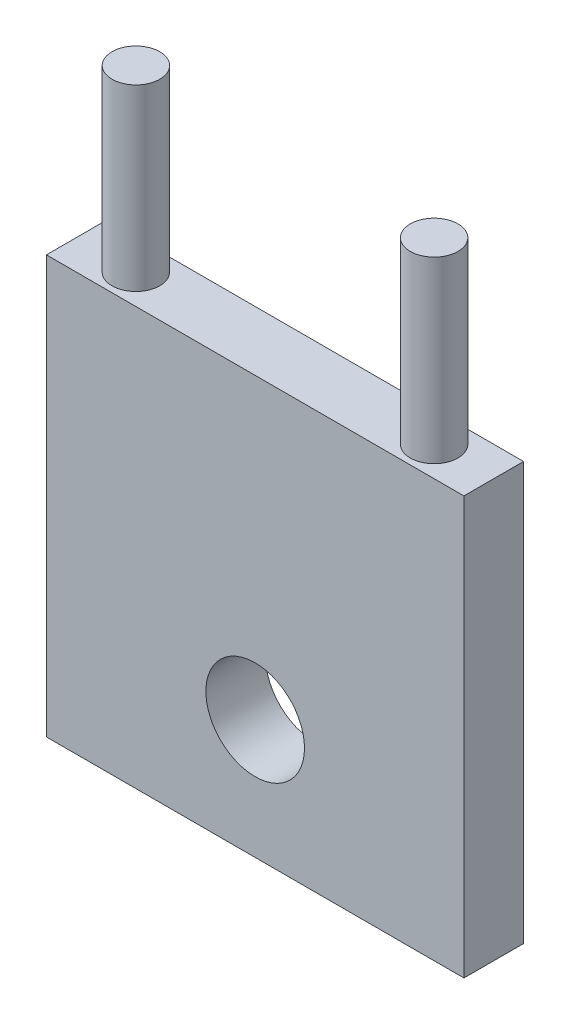
from build123d import *

# Parameters (mm, degrees)
SKETCH1_W           = 17.78
SKETCH1_H           = 17.78
SKETCH1_R           = 2.0999958
BOSS_EXTRUDE1_DEPTH = 2.54
SKETCH2_R           = 1.016
BOSS_EXTRUDE2_DEPTH = 7.62


with BuildPart() as part:
    # Sketch1 → Boss-Extrude1 (new body)
    with BuildSketch(Plane.XY):
        with Locations((8.89, 8.89)):
            Rectangle(SKETCH1_W, SKETCH1_H)
        with Locations((8.89, 5.08)):
            Circle(SKETCH1_R, mode=Mode.SUBTRACT)
    extrude(amount=-BOSS_EXTRUDE1_DEPTH)

    # Sketch2 → Boss-Extrude2 (add)
    with BuildSketch(Plane(origin=(0, 17.78, 0), x_dir=(1, 0, 0), z_dir=(0, 1, 0))):
        with Locations(Location((2.54, 1.27, 0), (0, 0, 90))):
            Circle(SKETCH2_R)
        with Locations(Location((15.24, 1.27, 0), (0, 0, 90))):
            Circle(SKETCH2_R)
    extrude(amount=BOSS_EXTRUDE2_DEPTH)


solid = part.part
